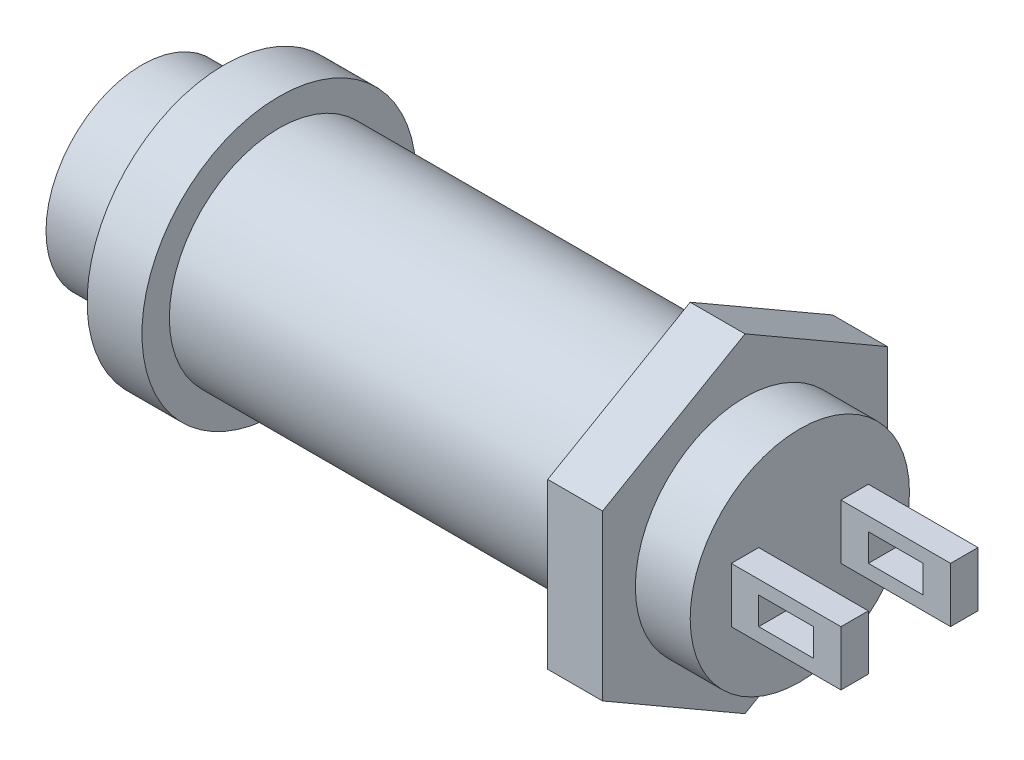
from build123d import *

# Parameters (mm, degrees)
CORTAR_EXTRUIR2_DEPTH   = 2
CROQUIS3_W              = 1
CROQUIS3_H              = 2
SALIENTE_EXTRUIR1_DEPTH = 4
CROQUIS5_W              = 2
CROQUIS5_H              = 1
CORTAR_EXTRUIR3_DEPTH   = 10


with BuildPart() as part:
    # Croquis1 → Revolución1 (revolve)
    with BuildSketch(Plane.XY):
        Polygon((0, 0), (0, 0.5), (10, 0.5), (10, 2.5), (0, 2.5), (0, 3.5), (3, 3.5), (3, 5), (5, 5), (5, 4), (20, 4), (20, 6), (22, 6), (22, 4), (24, 4), (24, 0), align=None)
    revolve(axis=Axis((24, 0, 0), (-1, 0, 0)))

    # Croquis2 → Cortar-Extruir2 (cut)
    with BuildSketch(Plane(origin=(22, 0, 0), x_dir=(0, 0, -1), z_dir=(1, 0, 0))):
        with BuildLine():
            ThreePointArc((5.196152423, 3), (3, 5.196152423), (0, 6))
            Line((0, 6), (5.196152423, 3))
        make_face()
        with BuildLine():
            Line((-5.196152423, 3), (0, 6))
            ThreePointArc((0, 6), (-3, 5.196152423), (-5.196152423, 3))
        make_face()
        with BuildLine():
            Line((-5.196152423, -3), (-5.196152423, 3))
            ThreePointArc((-5.196152423, 3), (-6, 0), (-5.196152423, -3))
        make_face()
        with BuildLine():
            ThreePointArc((5.196152423, -3), (6, 0), (5.196152423, 3))
            Line((5.196152423, 3), (5.196152423, -3))
        make_face()
        with BuildLine():
            Line((0, -6), (-5.196152423, -3))
            ThreePointArc((-5.196152423, -3), (-3, -5.196152423), (0, -6))
        make_face()
        with BuildLine():
            ThreePointArc((0, -6), (3, -5.196152423), (5.196152423, -3))
            Line((5.196152423, -3), (0, -6))
        make_face()
    extrude(amount=-CORTAR_EXTRUIR2_DEPTH, mode=Mode.SUBTRACT)

    # Croquis3 → Saliente-Extruir1 (add)
    with BuildSketch(Plane(origin=(24, 0, 0), x_dir=(0, 0, -1), z_dir=(1, 0, 0))):
        with Locations((-2, -0.001163142)):
            Rectangle(CROQUIS3_W, CROQUIS3_H)
        with Locations((2, 0)):
            Rectangle(CROQUIS3_W, CROQUIS3_H)
    extrude(amount=SALIENTE_EXTRUIR1_DEPTH)

    # Croquis5 → Cortar-Extruir3 (cut)
    with BuildSketch(Plane(origin=(0, 0, -2.5), x_dir=(-1, 0, 0), z_dir=(0, 0, -1))):
        with Locations((-26, 0)):
            Rectangle(CROQUIS5_W, CROQUIS5_H)
    extrude(amount=-CORTAR_EXTRUIR3_DEPTH, mode=Mode.SUBTRACT)


solid = part.part
